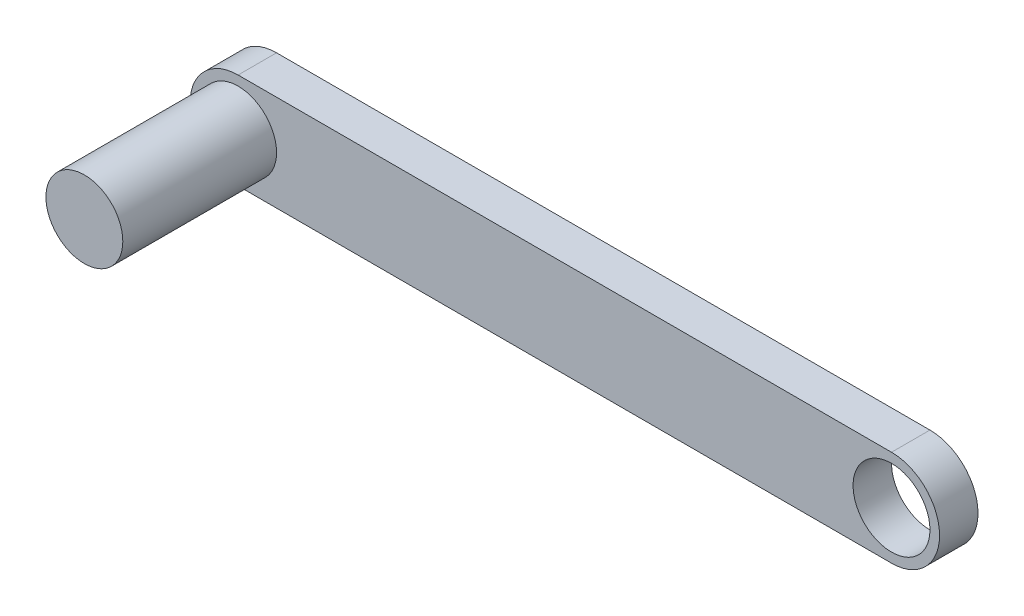
from build123d import *

# Parameters (mm, degrees)
BOSS_EXTRUDE1_DEPTH = 2
SKETCH2_R           = 2
BOSS_EXTRUDE2_DEPTH = 8
SKETCH5_R           = 2
CUT_EXTRUDE2_DEPTH  = 4


with BuildPart() as part:
    # Sketch1 → Boss-Extrude1 (new body)
    with BuildSketch(Plane.XY):
        with BuildLine():
            Line((0, -2.5), (34, -2.5))
            ThreePointArc((34, -2.5), (36.5, 0), (34, 2.5))
            Line((34, 2.5), (0, 2.5))
            ThreePointArc((0, 2.5), (-2.5, 0), (0, -2.5))
        make_face()
    extrude(amount=BOSS_EXTRUDE1_DEPTH)

    # Sketch2 → Boss-Extrude2 (add)
    with BuildSketch(Plane.XY.offset(2)):
        Circle(SKETCH2_R)
    extrude(amount=BOSS_EXTRUDE2_DEPTH)

    # Sketch5 → Cut-Extrude2 (cut, symmetric)
    with BuildSketch(Plane(origin=(0, 0, 0), x_dir=(-1, 0, 0), z_dir=(0, 0, -1))):
        with Locations(Location((-34, 0, 0), (0, 0, 180))):
            Circle(SKETCH5_R)
    extrude(amount=CUT_EXTRUDE2_DEPTH, both=True, mode=Mode.SUBTRACT)


solid = part.part
